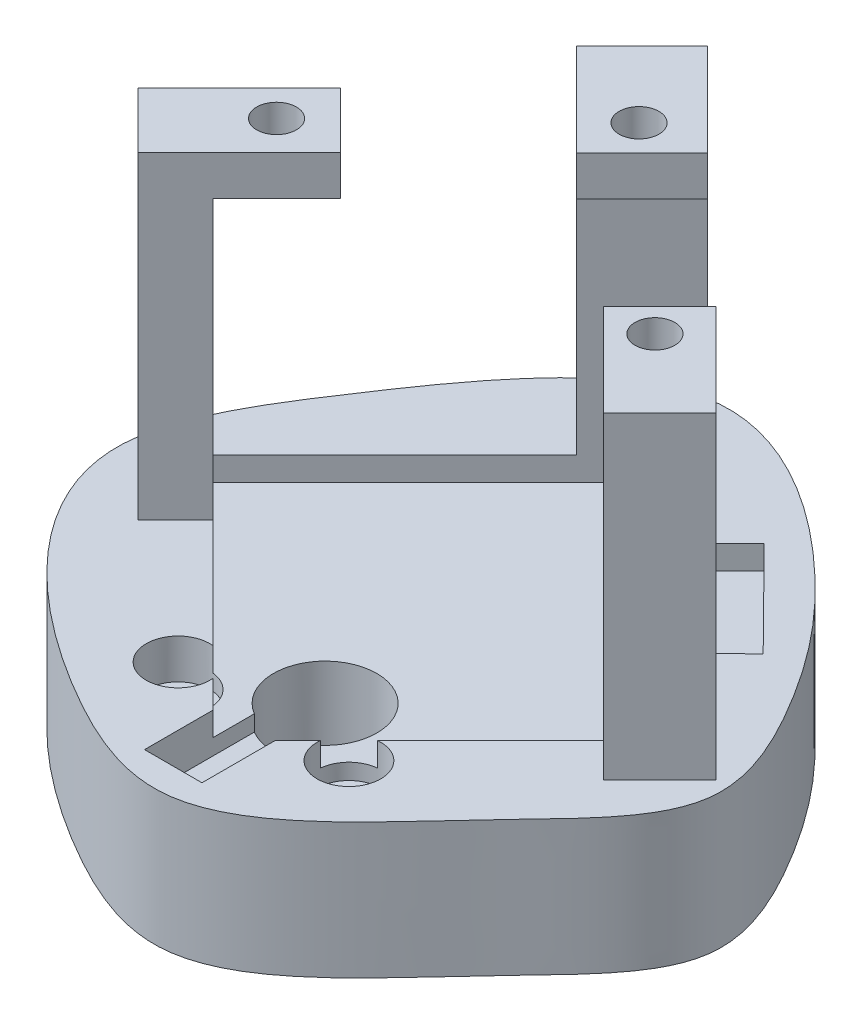
from build123d import *

# Parameters (mm, degrees)
SKETCH2_R           = 60
BOSS_EXTRUDE1_DEPTH = 17
SKETCH4_R           = 6.5
CUT_EXTRUDE1_DEPTH  = 17
SKETCH7_R           = 4
CUT_EXTRUDE2_DEPTH  = 5
SKETCH8_W           = 7.226657057
SKETCH8_H           = 13.816897518
CUT_EXTRUDE3_DEPTH  = 5
CUT_EXTRUDE4_DEPTH  = 3
CUT_EXTRUDE5_DEPTH  = 3
BOSS_EXTRUDE2_DEPTH = 35
BOSS_EXTRUDE3_DEPTH = 5
SKETCH13_R          = 2.5
CUT_EXTRUDE7_DEPTH  = 5
SKETCH15_R          = 2.5
CUT_EXTRUDE8_DEPTH  = 5
SKETCH14_R          = 2.5
CUT_EXTRUDE9_DEPTH  = 5
CUT_EXTRUDE10_START = -17
SKETCH16_R          = 60
CUT_EXTRUDE10_DEPTH = 17


with BuildPart() as part:
    # Sketch2 → Boss-Extrude1 (new body)
    with BuildSketch(Plane(origin=(0, 0, 0), x_dir=(1, 0, 0), z_dir=(0, 1, 0))):
        with Locations(Location((0, 0, 0), (0, 0, 270))):
            Circle(SKETCH2_R)
    extrude(amount=BOSS_EXTRUDE1_DEPTH)

    # Sketch4 → Cut-Extrude1 (cut)
    with BuildSketch(Plane(origin=(0, 17, 0), x_dir=(1, 0, 0), z_dir=(0, 1, 0))):
        with Locations(Location((0, 0, 0), (0, 0, 270))):
            Circle(SKETCH4_R)
    extrude(amount=-CUT_EXTRUDE1_DEPTH, mode=Mode.SUBTRACT)

    # Sketch7 → Cut-Extrude2 (cut)
    with BuildSketch(Plane(origin=(0, 17, 0), x_dir=(1, 0, 0), z_dir=(0, 1, 0))):
        with Locations(Location((-10.75, -7.75, 0), (0, 0, 270))):
            Circle(SKETCH7_R)
    cut_extrude2 = extrude(amount=-CUT_EXTRUDE2_DEPTH, mode=Mode.SUBTRACT)

    # Mirror1: Cut-Extrude2 across plane
    add(cut_extrude2.mirror(Plane(origin=(0, 0, 0), x_dir=(0, 0, 1), z_dir=(1, 0, 0))), mode=Mode.SUBTRACT)

    # Sketch8 → Cut-Extrude3 (cut)
    with BuildSketch(Plane(origin=(0, 17, 0), x_dir=(1, 0, 0), z_dir=(0, 1, 0))):
        with Locations((0.306588, -12.504471192)):
            Rectangle(SKETCH8_W, SKETCH8_H)
    extrude(amount=-CUT_EXTRUDE3_DEPTH, mode=Mode.SUBTRACT)

    # Sketch9 → Cut-Extrude4 (cut)
    with BuildSketch(Plane(origin=(0, 17, 0), x_dir=(1, 0, 0), z_dir=(0, 1, 0))):
        Polygon((-31.112706744, 17), (-8.372e-06, 48.112698372), (31.11269, 17), (-8.372e-06, -14.112698372), align=None)
    extrude(amount=-CUT_EXTRUDE4_DEPTH, mode=Mode.SUBTRACT)

    # Sketch6 → Cut-Extrude5 (cut)
    with BuildSketch(Plane(origin=(0, 17, 0), x_dir=(1, 0, 0), z_dir=(0, 1, 0))):
        Polygon((-5.977874391, 23.042765738), (5.977874391, 10.957234262), (25.17254203, 29.945776443), (13.216793249, 42.03130792), align=None)
    extrude(amount=-CUT_EXTRUDE5_DEPTH, mode=Mode.SUBTRACT)

    # Sketch11 → Boss-Extrude2 (add)
    with BuildSketch(Plane(origin=(0, 17, 0), x_dir=(1, 0, 0), z_dir=(0, 1, 0))):
        Polygon((-8.372e-06, 48.112698372), (-8.240017503, 39.872689242), (-12.799306685, 44.431978425), (-4.559297555, 52.671987555), align=None)
        Polygon((-31.112706744, 17), (-24.041638933, 9.928932188), (-28.755220541, 5.21535058), (-35.826288353, 12.286418392), align=None)
        Polygon((31.644591703, 17.531901703), (24.573523891, 10.460833891), (28.864455193, 6.169902588), (35.935523005, 13.2409704), align=None)
    extrude(amount=BOSS_EXTRUDE2_DEPTH)

    # Sketch12 → Boss-Extrude3 (add)
    with BuildSketch(Plane(origin=(0, 52, 0), x_dir=(1, 0, 0), z_dir=(0, 1, 0))):
        Polygon((-4.559297555, 52.671987555), (-12.799306685, 44.431978425), (-1.132044796, 32.764716535), (7.107964335, 41.004725665), align=None)
        Polygon((-35.826288353, 12.286418392), (-28.755220541, 5.21535058), (-16.027298479, 17.943272641), (-23.098366291, 25.014340453), align=None)
        Polygon((35.935523005, 13.2409704), (28.864455193, 6.169902588), (17.266701717, 17.767656064), (24.337769529, 24.838723876), align=None)
    extrude(amount=BOSS_EXTRUDE3_DEPTH)

    # Sketch13 → Cut-Extrude7 (cut)
    with BuildSketch(Plane(origin=(0, 57, 0), x_dir=(1, 0, 0), z_dir=(0, 1, 0))):
        with Locations(Location((-0.5, 40, 0), (0, 0, 270))):
            Circle(SKETCH13_R)
    extrude(amount=-CUT_EXTRUDE7_DEPTH, mode=Mode.SUBTRACT)

    # Sketch15 → Cut-Extrude8 (cut)
    with BuildSketch(Plane(origin=(0, 57, 0), x_dir=(1, 0, 0), z_dir=(0, 1, 0))):
        with Locations(Location((-23.777002133, 17.668993601, 0), (0, 0, 270))):
            Circle(SKETCH15_R)
    extrude(amount=-CUT_EXTRUDE8_DEPTH, mode=Mode.SUBTRACT)

    # Sketch14 → Cut-Extrude9 (cut)
    with BuildSketch(Plane(origin=(0, 57, 0), x_dir=(1, 0, 0), z_dir=(0, 1, 0))):
        with Locations(Location((23.5, 18, 0), (0, 0, 270))):
            Circle(SKETCH14_R)
    extrude(amount=-CUT_EXTRUDE9_DEPTH, mode=Mode.SUBTRACT)

    # Sketch16 → Cut-Extrude10 (cut)
    with BuildSketch(Plane(origin=(0, 17, 0), x_dir=(1, 0, 0), z_dir=(0, 1, 0)).offset(CUT_EXTRUDE10_START)):
        Circle(SKETCH16_R)
        with BuildLine():
            add(Edge.make_bspline(
                [(-4.79445414, 54.411479542), (3.711953261, 55.123778385), (20.176812176, 43.163893552), (32.095851639, 27.739664068), (41.103501035, 9.384731909), (23.441378071, -7.012281145), (7.387216057, -27.669539214), (-20.675561177, -15.265601832), (-45.215914175, 6.863059518), (-27.534475147, 35.312307502), (-14.416385352, 53.60577037), (-4.79445414, 54.411479542)],
                knots=[0, 0, 0, 0, 0.129983166, 0.216069769, 0.283536175, 0.368923683, 0.507401419, 0.580069943, 0.753753629, 0.852970941, 1, 1, 1, 1], degree=3))
        make_face(mode=Mode.SUBTRACT)
    extrude(amount=CUT_EXTRUDE10_DEPTH, mode=Mode.SUBTRACT)


solid = part.part
